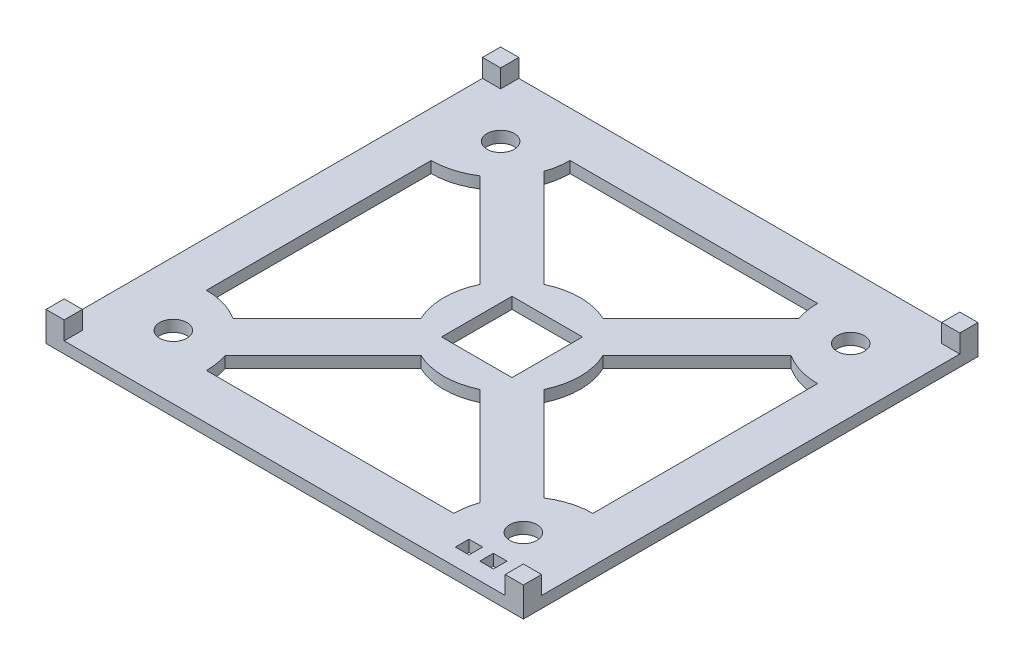
from build123d import *

# Parameters (mm, degrees)
SKETCH1_W           = 105
SKETCH1_H           = 100
BOSS_EXTRUDE1_DEPTH = 2.5
SKETCH3_W           = 4
SKETCH3_H           = 4
BOSS_EXTRUDE2_DEPTH = 4
SKETCH5_W           = 85
SKETCH5_H           = 80
CUT_EXTRUDE2_DEPTH  = 4
SKETCH6_R           = 15
BOSS_EXTRUDE3_DEPTH = 2.5
SKETCH7_W           = 15.5
SKETCH7_H           = 15.5
CUT_EXTRUDE3_DEPTH  = 2.5
BOSS_EXTRUDE4_DEPTH = 2.5
EXTRUDE_THIN2_DEPTH = 2.5
SKETCH10_R          = 3
CUT_EXTRUDE5_DEPTH  = 2.5
SKETCH11_W          = 3
SKETCH11_H          = 3
CUT_EXTRUDE6_DEPTH  = 2.5


with BuildPart() as part:
    # Sketch1 → Boss-Extrude1 (new body)
    with BuildSketch(Plane(origin=(0, 0, 0), x_dir=(1, 0, 0), z_dir=(0, 1, 0))):
        Rectangle(SKETCH1_W, SKETCH1_H)
    extrude(amount=BOSS_EXTRUDE1_DEPTH)

    # Sketch3 → Boss-Extrude2 (add)
    with BuildSketch(Plane(origin=(0, 2.5, 0), x_dir=(1, 0, 0), z_dir=(0, 1, 0))):
        with Locations((-50.5, 48)):
            Rectangle(SKETCH3_W, SKETCH3_H)
        with Locations((50.5, 48)):
            Rectangle(SKETCH3_W, SKETCH3_H)
        with Locations((50.5, -48)):
            Rectangle(SKETCH3_W, SKETCH3_H)
        with Locations((-50.5, -48)):
            Rectangle(SKETCH3_W, SKETCH3_H)
    extrude(amount=BOSS_EXTRUDE2_DEPTH)

    # Sketch5 → Cut-Extrude2 (cut)
    with BuildSketch(Plane(origin=(0, 2.5, 0), x_dir=(1, 0, 0), z_dir=(0, 1, 0))):
        Rectangle(SKETCH5_W, SKETCH5_H)
    extrude(amount=-CUT_EXTRUDE2_DEPTH, mode=Mode.SUBTRACT)

    # Sketch8 → Boss-Extrude4 (add)
    with BuildSketch(Plane(origin=(0, 2.5, 0), x_dir=(1, 0, 0), z_dir=(0, 1, 0))):
        with BuildLine():
            Line((-42.5, -40), (-27.220069463, -40))
            ThreePointArc((-27.220069463, -40), (-31.695457502, -29.195457502), (-42.5, -24.720069463))
            Line((-42.5, -24.720069463), (-42.5, -40))
        make_face()
        with BuildLine():
            ThreePointArc((-42.5, 24.720069463), (-31.695457502, 29.195457502), (-27.220069463, 40))
            Line((-27.220069463, 40), (-42.5, 40))
            Line((-42.5, 40), (-42.5, 24.720069463))
        make_face()
        with BuildLine():
            Line((42.5, 40), (27.220069463, 40))
            ThreePointArc((27.220069463, 40), (31.695457502, 29.195457502), (42.5, 24.720069463))
            Line((42.5, 24.720069463), (42.5, 40))
        make_face()
        with BuildLine():
            ThreePointArc((42.5, -24.720069463), (31.695457502, -29.195457502), (27.220069463, -40))
            Line((27.220069463, -40), (42.5, -40))
            Line((42.5, -40), (42.5, -24.720069463))
        make_face()
    extrude(amount=-BOSS_EXTRUDE4_DEPTH)



with BuildPart() as body_2:
    # Sketch6 → Boss-Extrude3 (new body)
    with BuildSketch(Plane(origin=(0, 2.5, 0), x_dir=(1, 0, 0), z_dir=(0, 1, 0))):
        with Locations(Location((0, 0, 0), (0, 0, 270))):
            Circle(SKETCH6_R)
    extrude(amount=-BOSS_EXTRUDE3_DEPTH)

    # Sketch7 → Cut-Extrude3 (cut)
    with BuildSketch(Plane(origin=(0, 2.5, 0), x_dir=(1, 0, 0), z_dir=(0, 1, 0))):
        Rectangle(SKETCH7_W, SKETCH7_H)
    extrude(amount=-CUT_EXTRUDE3_DEPTH, mode=Mode.SUBTRACT)


with BuildPart() as part_1:
    add(part.part)

    add(body_2.part)  # Extrude-Thin2 merges body 2
    # Sketch9 → Extrude-Thin2 (add)
    with BuildSketch(Plane(origin=(0, 2.5, 0), x_dir=(1, 0, 0), z_dir=(0, 1, 0))):
        Polygon((4.214466094, -11.285533906), (34.46870341, -41.539771222), (41.539771222, -34.46870341), (11.285533906, -4.214466094), align=None)
        Polygon((-11.285533906, -4.214466094), (-41.539771222, -34.46870341), (-34.46870341, -41.539771222), (-4.214466094, -11.285533906), align=None)
        Polygon((11.285533906, 4.214466094), (41.539771222, 34.46870341), (34.46870341, 41.539771222), (4.214466094, 11.285533906), align=None)
        Polygon((-4.214466094, 11.285533906), (-34.46870341, 41.539771222), (-41.539771222, 34.46870341), (-11.285533906, 4.214466094), align=None)
    extrude(amount=-EXTRUDE_THIN2_DEPTH)

    # Sketch10 → Cut-Extrude5 (cut)
    with BuildSketch(Plane(origin=(0, 2.5, 0), x_dir=(1, 0, 0), z_dir=(0, 1, 0))):
        with Locations(Location((38.5, 36, 0), (0, 0, 270))):
            Circle(SKETCH10_R)
        with Locations(Location((-38.5, 36, 0), (0, 0, 90))):
            Circle(SKETCH10_R)
        with Locations(Location((38.5, -36, 0), (0, 0, 90))):
            Circle(SKETCH10_R)
        with Locations(Location((-38.5, -36, 0), (0, 0, 270))):
            Circle(SKETCH10_R)
    extrude(amount=-CUT_EXTRUDE5_DEPTH, mode=Mode.SUBTRACT)

    # Sketch11 → Cut-Extrude6 (cut)
    with BuildSketch(Plane(origin=(0, 2.5, 0), x_dir=(1, 0, 0), z_dir=(0, 1, 0))):
        with Locations((40.657260224, -44.752137111)):
            Rectangle(SKETCH11_W, SKETCH11_H)
        with Locations((35.291405318, -44.752137111)):
            Rectangle(SKETCH11_W, SKETCH11_H)
    extrude(amount=-CUT_EXTRUDE6_DEPTH, mode=Mode.SUBTRACT)


solid = part_1.part
